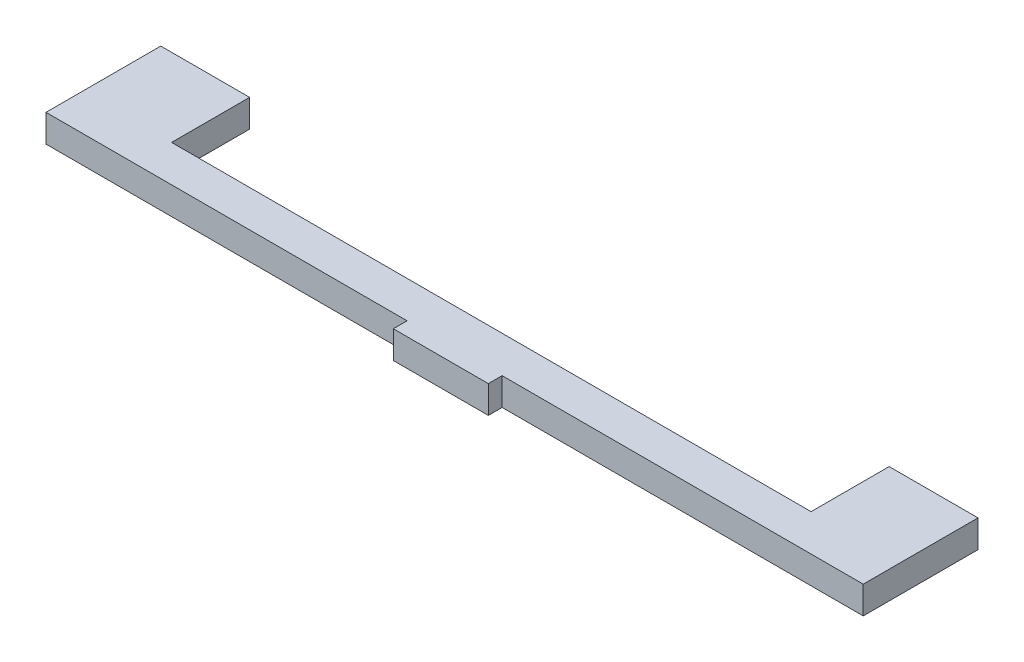
from build123d import *

# Parameters (mm, degrees)
BOSS_EXTRUDE1_DEPTH = 6


with BuildPart() as part:
    # Sketch1 → Boss-Extrude1 (new body)
    with BuildSketch(Plane(origin=(0, 0, 0), x_dir=(1, 0, 0), z_dir=(0, 1, 0))):
        Polygon((-9.91875, -12.98515625), (10.78125, -12.98515625), (10.78125, -9.98515625), (89.43125, -9.98515625), (89.43125, 15.01484375), (70.078125, 15.01484375), (70.078125, -1.98515625), (-69.215625, -1.98515625), (-69.215625, 15.01484375), (-88.56875, 15.01484375), (-88.56875, -9.98515625), (-9.91875, -9.98515625), align=None)
    extrude(amount=BOSS_EXTRUDE1_DEPTH)


solid = part.part
